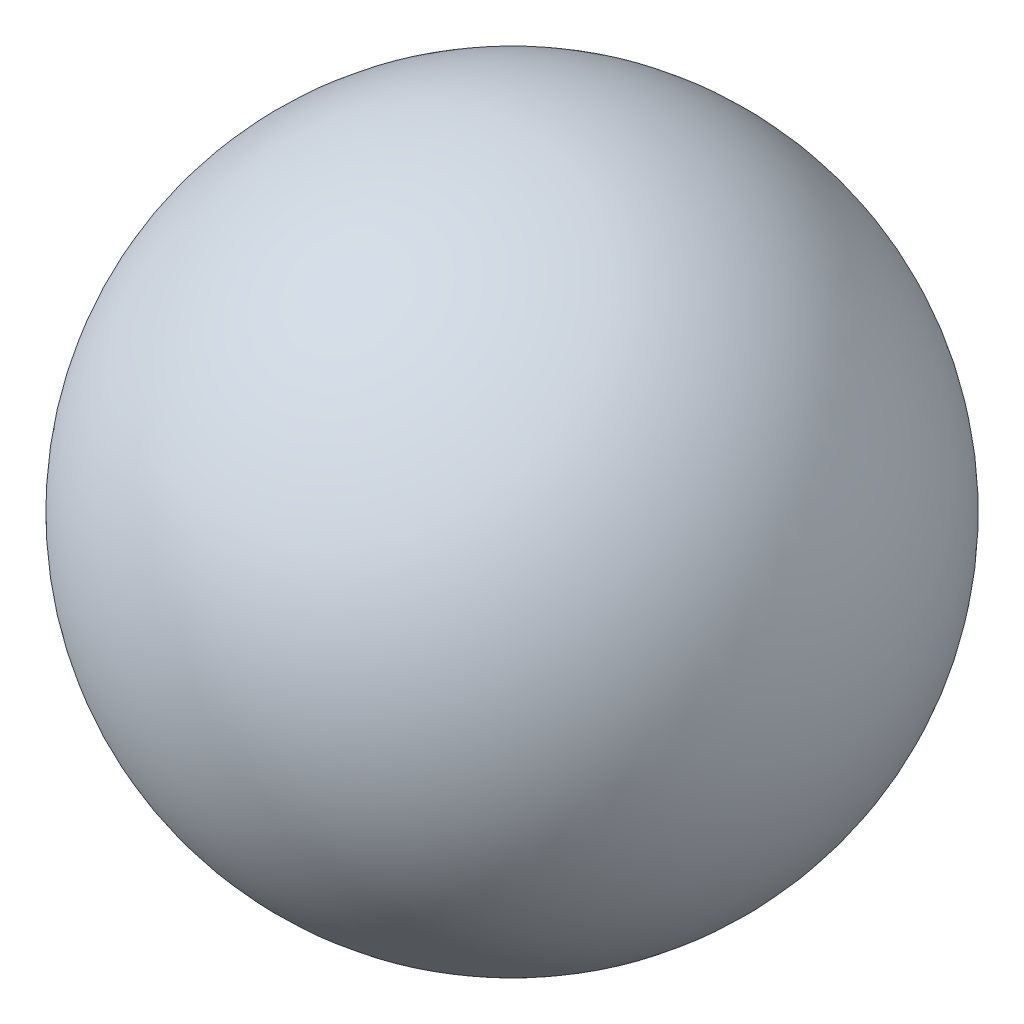
from build123d import *


with BuildPart() as part:
    # Sketch1 → Revolve1 (revolve)
    with BuildSketch(Plane.XY):
        with BuildLine():
            Line((0, 20.32), (0, -20.32))
            ThreePointArc((0, -20.32), (-20.32, 0), (0, 20.32))
        make_face()
    revolve(axis=Axis((0, 53.314752726, 0), (0, -1, 0)))


solid = part.part
